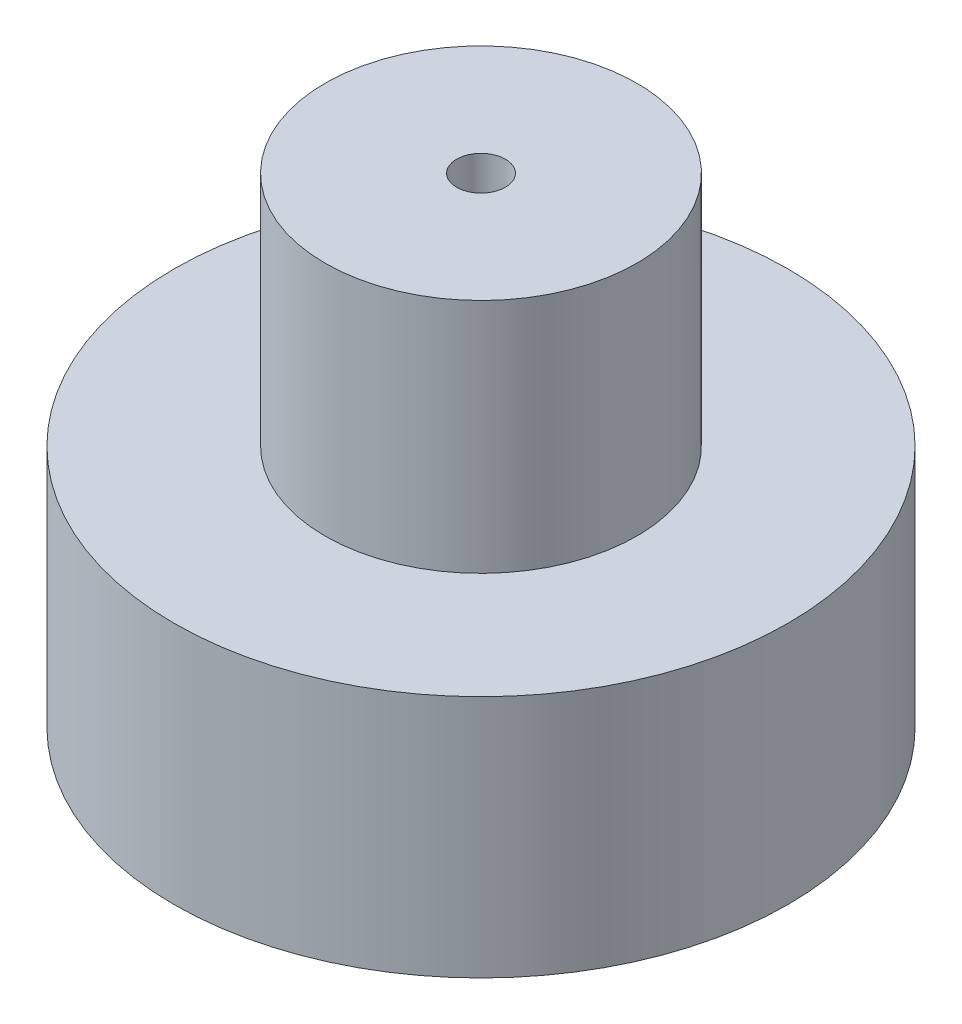
from build123d import *

# Parameters (mm, degrees)
ESQUISSE1_R        = 12.6
BOSS_EXTRU_1_DEPTH = 10
ESQUISSE2_R        = 6.4
BOSS_EXTRU_2_DEPTH = 9.7
D_GAGEMENT_M1_61_D = 2


with BuildPart() as part:
    # Esquisse1 → Boss.-Extru.1 (new body)
    with BuildSketch(Plane(origin=(0, 0, 0), x_dir=(1, 0, 0), z_dir=(0, 1, 0))):
        with Locations(Location((0, 0, 0), (0, 0, 270))):
            Circle(ESQUISSE1_R)
    extrude(amount=BOSS_EXTRU_1_DEPTH)

    # Esquisse2 → Boss.-Extru.2 (add)
    with BuildSketch(Plane(origin=(0, 10, 0), x_dir=(1, 0, 0), z_dir=(0, 1, 0))):
        with Locations(Location((0, 0, 0), (0, 0, 270))):
            Circle(ESQUISSE2_R)
    extrude(amount=BOSS_EXTRU_2_DEPTH)

    # Dégagement M1.61 (through all)
    with Locations(Plane(origin=(0, 19.7, 0), x_dir=(1, 0, 0), z_dir=(0, 1, 0))):
        with Locations((0, 0)):
            Hole(D_GAGEMENT_M1_61_D / 2)


solid = part.part
